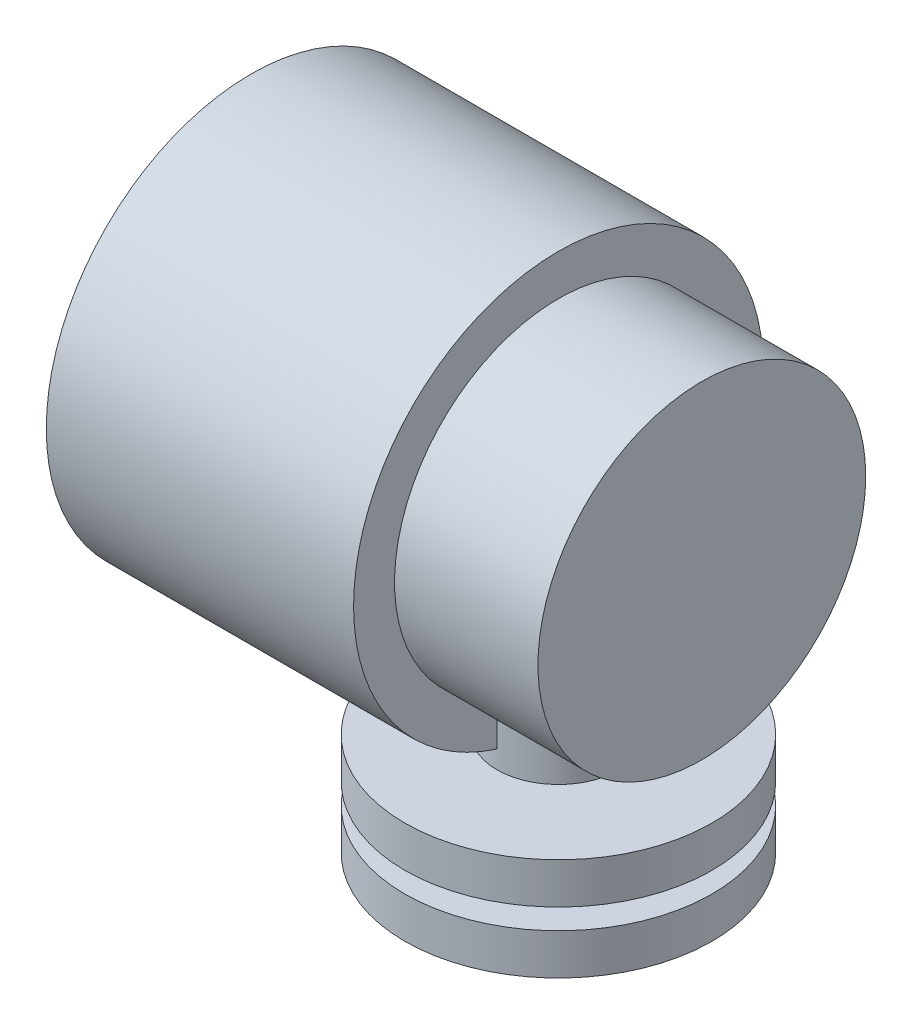
from build123d import *

# Parameters (mm, degrees)
SKETCH1_R           = 75
BOSS_EXTRUDE1_DEPTH = 20
SKETCH2_R           = 60
BOSS_EXTRUDE2_DEPTH = 10
SKETCH3_R           = 75
BOSS_EXTRUDE3_DEPTH = 20
SKETCH4_R           = 30
BOSS_EXTRUDE4_DEPTH = 100
SKETCH5_R           = 100
BOSS_EXTRUDE5_DEPTH = 150
SKETCH6_R           = 80
BOSS_EXTRUDE6_DEPTH = 70


with BuildPart() as part:
    # Sketch1 → Boss-Extrude1 (new body)
    with BuildSketch(Plane(origin=(0, 0, 0), x_dir=(1, 0, 0), z_dir=(0, 1, 0))):
        with Locations(Location((0, 0, 0), (0, 0, 270))):
            Circle(SKETCH1_R)
    extrude(amount=BOSS_EXTRUDE1_DEPTH)

    # Sketch2 → Boss-Extrude2 (add)
    with BuildSketch(Plane(origin=(0, 20, 0), x_dir=(1, 0, 0), z_dir=(0, 1, 0))):
        with Locations(Location((0, 0, 0), (0, 0, 270))):
            Circle(SKETCH2_R)
    extrude(amount=BOSS_EXTRUDE2_DEPTH)

    # Sketch3 → Boss-Extrude3 (add)
    with BuildSketch(Plane(origin=(0, 30, 0), x_dir=(1, 0, 0), z_dir=(0, 1, 0))):
        with Locations(Location((0, 0, 0), (0, 0, 270))):
            Circle(SKETCH3_R)
    extrude(amount=BOSS_EXTRUDE3_DEPTH)

    # Sketch4 → Boss-Extrude4 (add)
    with BuildSketch(Plane(origin=(0, 50, 0), x_dir=(1, 0, 0), z_dir=(0, 1, 0))):
        with Locations(Location((0, 0, 0), (0, 0, 270))):
            Circle(SKETCH4_R)
    extrude(amount=BOSS_EXTRUDE4_DEPTH)

    # Sketch5 → Boss-Extrude5 (add)
    with BuildSketch(Plane(origin=(0, 0, 0), x_dir=(0, 0, -1), z_dir=(1, 0, 0))):
        with Locations((0, 154.201763101)):
            Circle(SKETCH5_R)
    extrude(amount=-BOSS_EXTRUDE5_DEPTH)

    # Sketch6 → Boss-Extrude6 (add)
    with BuildSketch(Plane(origin=(0, 0, 0), x_dir=(0, 0, -1), z_dir=(1, 0, 0))):
        with Locations(Location((0, 154.201763101, 0), (0, 0, 247.975687163))):
            Circle(SKETCH6_R)
    extrude(amount=BOSS_EXTRUDE6_DEPTH)


solid = part.part
